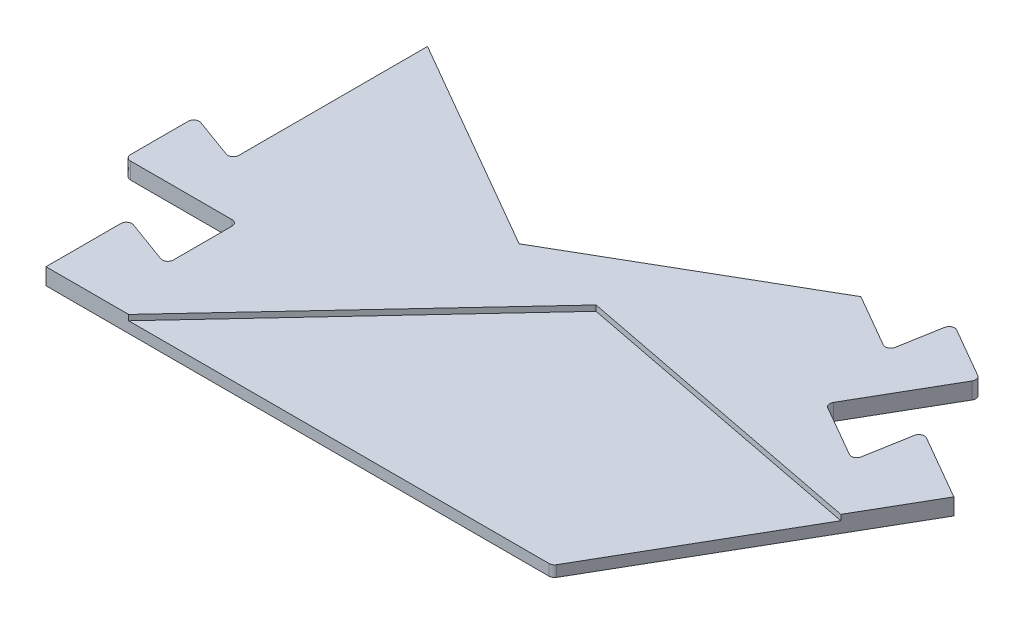
from build123d import *

# Parameters (mm, degrees)
P_IDAT_VYSUNUT_M1_DEPTH = 3
P_IDAT_VYSUNUT_M2_DEPTH = 2
ZAOBLIT1_R              = 1
ZAOBLIT2_R              = 1


with BuildPart() as part:
    # Skica1 → Přidat vysunutím1 (new body)
    with BuildSketch(Plane(origin=(0, 0, 0), x_dir=(1, 0, 0), z_dir=(0, 1, 0))):
        Polygon((118.524103266, 46.190077074), (105.53372221, 53.690077074), (103.593400635, 42.685966604), (92.248467845, 49.235966604), (102.473720104, 66.946623035), (91.301992395, 73.396623035), (89.463213481, 62.968389614), (78.635106664, 69.22), (39.317553332, 46.52), (0, 69.22), (0, 33.55662508), (-9.950504516, 37.17831254), (-9.950504516, 24.27831254), (10.5, 24.27831254), (10.5, 11.17831254), (0, 15), (0, 0), (15, 0), (55.910618513, 43.889876884), (111.018549767, 33.190077074), align=None)
    extrude(amount=P_IDAT_VYSUNUT_M1_DEPTH)

    # Skica1<3> → Přidat vysunutím2 (add)
    with BuildSketch(Plane(origin=(0, 0, 0), x_dir=(1, 0, 0), z_dir=(0, 1, 0))):
        Polygon((91.856249834, 0), (111.018549767, 33.190077074), (55.910618513, 43.889876884), (15, 0), align=None)
    extrude(amount=P_IDAT_VYSUNUT_M2_DEPTH)

    # Zaoblit1
    zaoblit1_edges = [part.edges().sort_by_distance(p)[0] for p in [
        (0, 1.5, -33.55662508),
        (-9.950504516, 1.5, -37.17831254),
        (10.5, 1.5, -24.27831254),
        (-9.950504516, 1.5, -24.27831254),
        (10.5, 1.5, -11.17831254),
        (0, 1.5, -15),
        (105.53372221, 1.5, -53.690077074),
        (103.593400635, 1.5, -42.685966604),
        (92.248467845, 1.5, -49.235966604),
        (89.463213481, 1.5, -62.968389614),
        (91.301992395, 1.5, -73.396623035),
        (102.473720104, 1.5, -66.946623035),
    ]]
    fillet(zaoblit1_edges, radius=ZAOBLIT1_R)

    # Zaoblit2
    zaoblit2_edges = [part.edges().sort_by_distance(p)[0] for p in [
        (91.856249834, 1, 0),
    ]]
    fillet(zaoblit2_edges, radius=ZAOBLIT2_R)


solid = part.part
